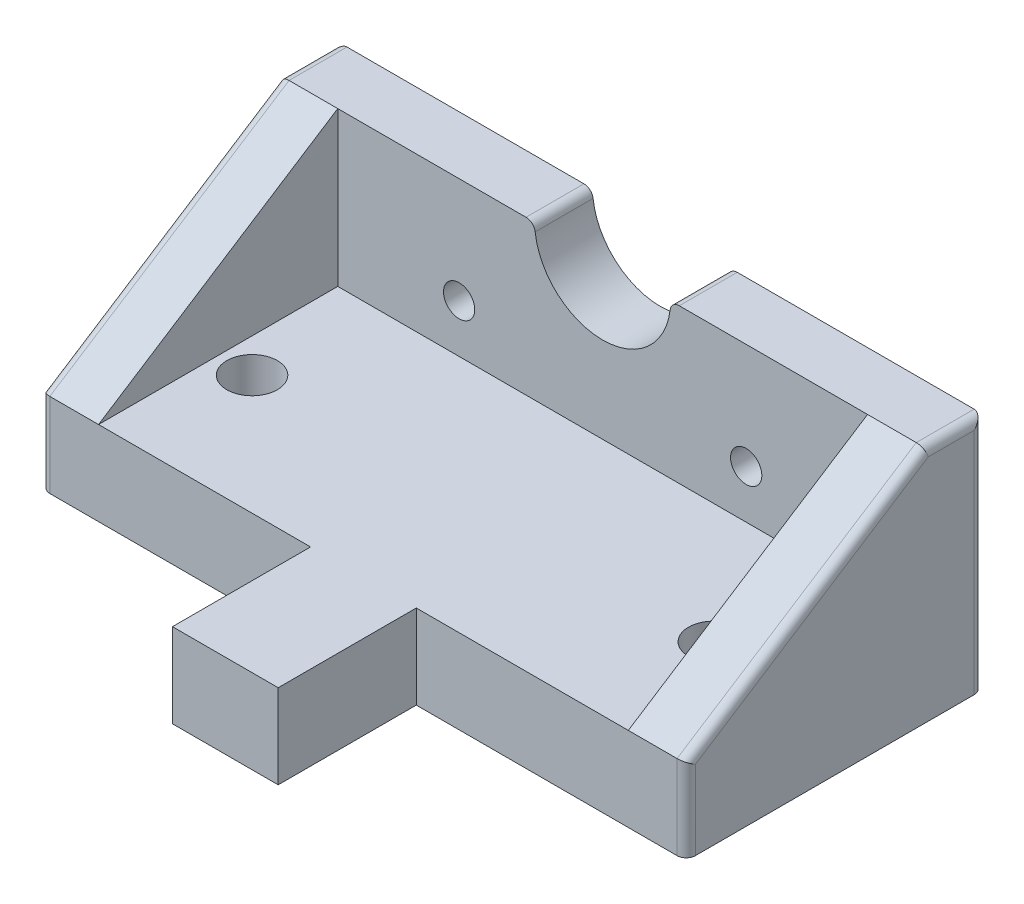
from build123d import *

# Parameters (mm, degrees)
SKETCH1_W                       = 70.22
SKETCH1_H                       = 25.9
BOSS_EXTRUDE1_DEPTH             = 47.34
SKETCH6_W                       = 29.36
SKETCH6_H                       = 15.02
CUT_EXTRUDE1_DEPTH              = 65.378549999
SKETCH8_W                       = 57.62
SKETCH8_H                       = 41.04
CUT_EXTRUDE2_DEPTH              = 16.75
CUT_EXTRUDE3_DEPTH              = 86.671620155
CUT_EXTRUDE4_DEPTH              = 56.540041412
CUT_EXTRUDE4_DEPTH_BACK         = 56.540041412
FILLET9_R                       = 1
CBORE_FOR_M3_SBHCS1_D           = 3.4
CBORE_FOR_M3_SBHCS1_CBORE_D     = 6.7
CBORE_FOR_M3_SBHCS1_CBORE_DEPTH = 1.65
CBORE_FOR_M5_SBHCS1_D           = 5.5
CBORE_FOR_M5_SBHCS1_CBORE_D     = 10.5
CBORE_FOR_M5_SBHCS1_CBORE_DEPTH = 2.75


with BuildPart() as part:
    # Sketch1 → Boss-Extrude1 (new body)
    with BuildSketch(Plane.XY):
        Rectangle(SKETCH1_W, SKETCH1_H)
    extrude(amount=-BOSS_EXTRUDE1_DEPTH)

    # Sketch6 → Cut-Extrude1 (cut, through all)
    with BuildSketch(Plane(origin=(0, 12.95, 0), x_dir=(1, 0, 0), z_dir=(0, 1, 0))):
        with Locations((-20.43, 7.51)):
            Rectangle(SKETCH6_W, SKETCH6_H)
    cut_extrude1 = extrude(amount=-CUT_EXTRUDE1_DEPTH, mode=Mode.SUBTRACT)

    # Mirror1: Cut-Extrude1 across plane
    add(cut_extrude1.mirror(Plane(origin=(0, 0, 0), x_dir=(0, 0, 1), z_dir=(1, 0, 0))), mode=Mode.SUBTRACT)

    # Sketch8 → Cut-Extrude2 (cut)
    with BuildSketch(Plane(origin=(0, 12.95, 0), x_dir=(1, 0, 0), z_dir=(0, 1, 0))):
        with Locations((0, 20.52)):
            Rectangle(SKETCH8_W, SKETCH8_H)
    extrude(amount=-CUT_EXTRUDE2_DEPTH, mode=Mode.SUBTRACT)

    # Sketch12 → Cut-Extrude3 (cut, through all)
    with BuildSketch(Plane(origin=(35.11, 0, 0), x_dir=(0, 0, -1), z_dir=(1, 0, 0))):
        Polygon((15.02, -3.8), (41.04, 12.95), (15.02, 12.95), align=None)
    extrude(amount=-CUT_EXTRUDE3_DEPTH, mode=Mode.SUBTRACT)

    # Sketch16 → Cut-Extrude4 (cut, two sides: drawn at the far end of the back side and taken through both)
    with BuildSketch(Plane.XY.offset(-41.04).offset(-CUT_EXTRUDE4_DEPTH_BACK)):
        with BuildLine():
            Line((-7.395445113, 122.499442273), (-7.395445113, 12.95))
            ThreePointArc((-7.395445113, 12.95), (0, 5.554554887), (7.395445113, 12.95))
            Line((7.395445113, 12.95), (7.395445113, 122.499442273))
            Line((7.395445113, 122.499442273), (7.395445113, 341.598326819))
            Line((7.395445113, 341.598326819), (-7.395445113, 341.598326819))
            Line((-7.395445113, 341.598326819), (-7.395445113, 122.499442273))
        make_face()
    extrude(amount=CUT_EXTRUDE4_DEPTH + CUT_EXTRUDE4_DEPTH_BACK, mode=Mode.SUBTRACT)

    # Fillet9
    fillet9_edges = [part.edges().sort_by_distance(p)[0] for p in [
        (-35.11, 0, -47.34),
        (7.395445113, 12.95, -44.19),
        (-7.395445113, 12.95, -44.19),
        (-35.11, -8.375, -15.02),
        (35.11, -8.375, -15.02),
        (35.11, 0, -47.34),
        (-35.11, 12.95, -44.19),
        (35.11, 12.95, -44.19),
        (-35.11, 4.575, -28.03),
        (35.11, 4.575, -28.03),
    ]]
    fillet(fillet9_edges, radius=FILLET9_R)

    # CBORE for M3 SBHCS1 (through all)
    with Locations(Plane(origin=(0, 0, -47.34), x_dir=(-1, 0, 0), z_dir=(0, 0, -1))):
        with Locations((-15.61, 1.45), (15.61, 1.45)):
            CounterBoreHole(CBORE_FOR_M3_SBHCS1_D / 2, CBORE_FOR_M3_SBHCS1_CBORE_D / 2, CBORE_FOR_M3_SBHCS1_CBORE_DEPTH)

    # CBORE for M5 SBHCS1 (through all)
    with Locations(Plane.XZ.offset(12.95)):
        with Locations((-25.11, -28.02), (25.11, -28.02)):
            CounterBoreHole(CBORE_FOR_M5_SBHCS1_D / 2, CBORE_FOR_M5_SBHCS1_CBORE_D / 2, CBORE_FOR_M5_SBHCS1_CBORE_DEPTH)


solid = part.part
